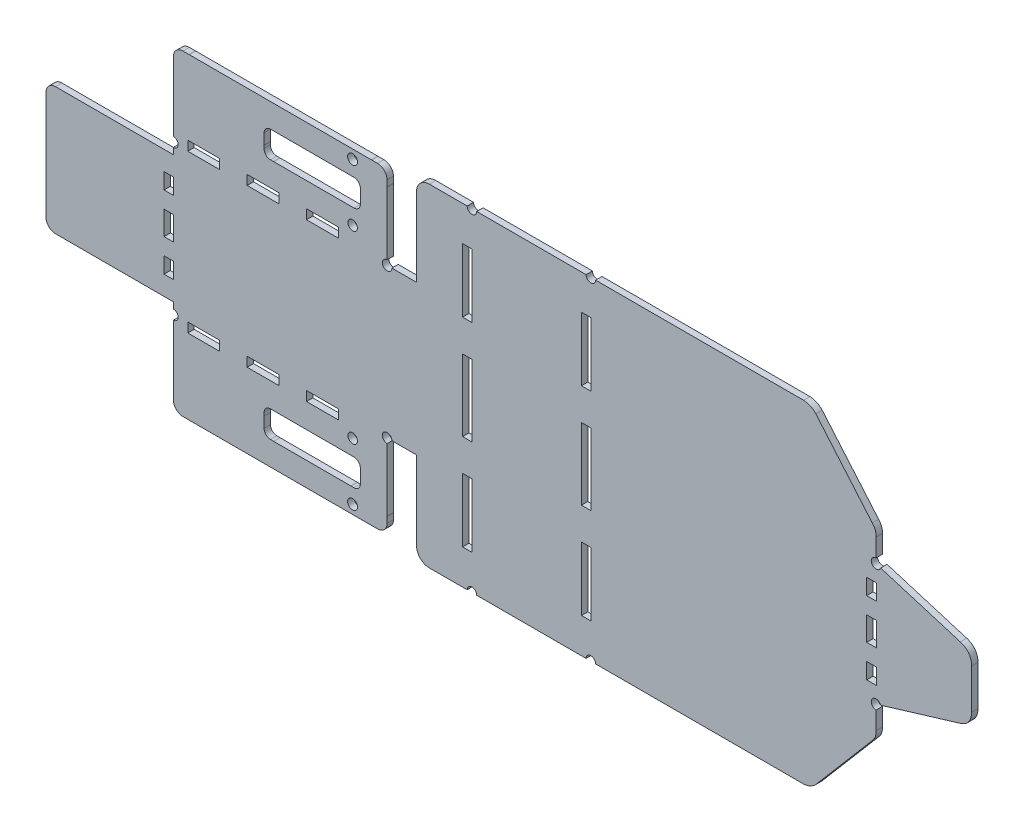
from build123d import *

# Parameters (mm, degrees)
MODEL_R                  = 1.565058428
MODEL_R_2                = 1.499491651
MODEL_W                  = 3
MODEL_H                  = 20
MODEL_W_2                = 10
MODEL_H_2                = 3
MODEL_H_3                = 22.475128394
MODEL_H_4                = 7.475128394
MODEL_H_5                = 5
RESSALTO_EXTRUS_O1_DEPTH = 2


with BuildPart() as part:
    # Model → Ressalto-extrusão1 (new body)
    with BuildSketch(Plane.XY):
        with BuildLine():
            Line((-37.913758519, 33.827030832), (-37.913758519, 63.827030832))
            Line((-37.913758519, 63.827030832), (-37.913758519, 65.827030832))
            ThreePointArc((-37.913758519, 65.827030832), (-37.035078863, 67.948351175), (-34.913758519, 68.827030832))
            Line((-34.913758519, 68.827030832), (-32.913758519, 68.827030832))
            Line((-32.913758519, 68.827030832), (2.086241481, 68.827030832))
            Line((2.086241481, 68.827030832), (2.086241481, 70.798296021))
            ThreePointArc((2.086241481, 70.798296021), (3.586241481, 72.298296021), (2.086241481, 73.798296021))
            Line((2.086241481, 73.798296021), (2.086241481, 93.521449254))
            Line((2.086241481, 93.521449254), (2.089156369, 93.692154805))
            Line((2.089156369, 93.692154805), (2.089156369, 95.518534366))
            ThreePointArc((2.089156369, 95.518534366), (2.967836026, 97.63985471), (5.089156369, 98.518534366))
            Line((5.089156369, 98.518534366), (6.91553593, 98.518534366))
            Line((6.91553593, 98.518534366), (7.086241481, 98.521449254))
            Line((7.086241481, 98.521449254), (64.178650092, 98.521449254))
            Line((64.178650092, 98.521449254), (64.349355643, 98.518534366))
            Line((64.349355643, 98.518534366), (66.175735204, 98.518534366))
            ThreePointArc((66.175735204, 98.518534366), (68.297055547, 97.63985471), (69.175735204, 95.518534366))
            Line((69.175735204, 95.518534366), (69.175735204, 93.692154805))
            Line((69.175735204, 93.692154805), (69.178650092, 93.521449254))
            Line((69.178650092, 93.521449254), (69.178650092, 73.798296021))
            ThreePointArc((69.178650092, 73.798296021), (68.11798992, 71.237635849), (70.678650092, 72.298296021))
            Line((70.678650092, 72.298296021), (78.413307207, 72.298296021))
            Line((78.413307207, 72.298296021), (78.413307207, 96.001255397))
            Line((78.413307207, 96.001255397), (78.413307207, 97.001255397))
            ThreePointArc((78.413307207, 97.001255397), (79.584880083, 99.829682522), (82.413307207, 101.001255397))
            Line((82.413307207, 101.001255397), (83.413307207, 101.001255397))
            Line((83.413307207, 101.001255397), (94.308618484, 101.001255397))
            ThreePointArc((94.308618484, 101.001255397), (95.808618484, 99.501255397), (97.308618484, 101.001255397))
            Line((97.308618484, 101.001255397), (131.635208551, 101.001255397))
            ThreePointArc((131.635208551, 101.001255397), (133.135208551, 99.501255397), (134.635208551, 101.001255397))
            Line((134.635208551, 101.001255397), (199.940156949, 101.001255397))
            add(Edge.make_bspline(
                [(199.940156949, 101.001255397), (202.179415573, 100.855441248), (203.746755471, 99.243138753)],
                knots=[0, 0, 0, 1, 1, 1], degree=2))
            Line((203.746755471, 99.243138753), (221.488437536, 78.410970135))
            add(Edge.make_bspline(
                [(221.488437536, 78.410970135), (222.762121913, 77.052932443), (222.681839015, 75.169086778)],
                knots=[0, 0, 0, 1, 1, 1], degree=2))
            Line((222.681839015, 75.169086778), (222.681839015, 69.497026257))
            ThreePointArc((222.681839015, 69.497026257), (221.445339271, 67.097014669), (224.117370065, 67.483328895))
            Line((224.117370065, 67.483328895), (249.131937115, 59.90280819))
            add(Edge.make_bspline(
                [(249.131937115, 59.90280819), (252.581492112, 58.852772143), (252.681839015, 55.11770469)],
                knots=[0, 0, 0, 1, 1, 1], degree=2))
            Line((252.681839015, 55.11770469), (252.681839015, 42.536356973))
            add(Edge.make_bspline(
                [(249.131937115, 37.751253474), (252.581492112, 38.80128952), (252.681839015, 42.536356973)],
                knots=[0, 0, 0, 1, 1, 1], degree=2))
            Line((249.131937115, 37.751253474), (224.117370065, 30.170732769))
            ThreePointArc((224.117370065, 30.170732769), (221.445339271, 30.557046995), (222.681839015, 28.157035406))
            Line((222.681839015, 28.157035406), (222.681839015, 22.484974885))
            add(Edge.make_bspline(
                [(221.488437536, 19.243091529), (222.762121913, 20.601129221), (222.681839015, 22.484974885)],
                knots=[0, 0, 0, 1, 1, 1], degree=2))
            Line((221.488437536, 19.243091529), (203.746755471, -1.58907709))
            add(Edge.make_bspline(
                [(199.940156949, -3.347193733), (202.179415573, -3.201379584), (203.746755471, -1.58907709)],
                knots=[0, 0, 0, 1, 1, 1], degree=2))
            Line((199.940156949, -3.347193733), (134.635208551, -3.347193733))
            ThreePointArc((134.635208551, -3.347193733), (133.135208551, -1.847193733), (131.635208551, -3.347193733))
            Line((131.635208551, -3.347193733), (97.308618484, -3.347193733))
            ThreePointArc((97.308618484, -3.347193733), (95.808618484, -1.847193733), (94.308618484, -3.347193733))
            Line((94.308618484, -3.347193733), (83.413307207, -3.347193733))
            Line((83.413307207, -3.347193733), (82.413307207, -3.347193733))
            ThreePointArc((82.413307207, -3.347193733), (79.584880083, -2.175620858), (78.413307207, 0.652806267))
            Line((78.413307207, 0.652806267), (78.413307207, 1.652806267))
            Line((78.413307207, 1.652806267), (78.413307207, 25.355765643))
            Line((78.413307207, 25.355765643), (70.678650092, 25.355765643))
            ThreePointArc((70.678650092, 25.355765643), (68.11798992, 26.416425814), (69.178650092, 23.855765643))
            Line((69.178650092, 23.855765643), (69.178650092, 4.132612409))
            Line((69.178650092, 4.132612409), (69.175735204, 3.961906858))
            Line((69.175735204, 3.961906858), (69.175735204, 2.135527297))
            ThreePointArc((69.175735204, 2.135527297), (68.297055547, 0.014206954), (66.175735204, -0.864472703))
            Line((66.175735204, -0.864472703), (64.349355643, -0.864472703))
            Line((64.349355643, -0.864472703), (64.178650092, -0.867387591))
            Line((64.178650092, -0.867387591), (7.086241481, -0.867387591))
            Line((7.086241481, -0.867387591), (6.91553593, -0.864472703))
            Line((6.91553593, -0.864472703), (5.089156369, -0.864472703))
            ThreePointArc((5.089156369, -0.864472703), (2.967836026, 0.014206954), (2.089156369, 2.135527297))
            Line((2.089156369, 2.135527297), (2.089156369, 3.961906858))
            Line((2.089156369, 3.961906858), (2.086241481, 4.132612409))
            Line((2.086241481, 4.132612409), (2.086241481, 23.855765643))
            ThreePointArc((2.086241481, 23.855765643), (3.586241481, 25.355765643), (2.086241481, 26.855765643))
            Line((2.086241481, 26.855765643), (2.086241481, 28.827030832))
            Line((2.086241481, 28.827030832), (-32.913758519, 28.827030832))
            Line((-32.913758519, 28.827030832), (-34.913758519, 28.827030832))
            ThreePointArc((-34.913758519, 28.827030832), (-37.035078863, 29.705710488), (-37.913758519, 31.827030832))
            Line((-37.913758519, 31.827030832), (-37.913758519, 33.827030832))
        make_face()
        with Locations((58.326419592, 95.720794846)):
            Circle(MODEL_R, mode=Mode.SUBTRACT)
        with Locations((58.364897566, 77.786537944)):
            Circle(MODEL_R_2, mode=Mode.SUBTRACT)
        with Locations((58.364897566, 19.86752372)):
            Circle(MODEL_R_2, mode=Mode.SUBTRACT)
        with Locations((58.326419592, 1.933266817)):
            Circle(MODEL_R, mode=Mode.SUBTRACT)
        Polygon((133.198496092, 47.589466635), (133.198496092, 37.589466635), (130.198496092, 37.589466635), (130.198496092, 60.064595029), (133.198496092, 60.064595029), (133.198496092, 50.064595029), align=None, mode=Mode.SUBTRACT)
        with Locations((94.371906025, 17.589466635)):
            Rectangle(MODEL_W, MODEL_H, mode=Mode.SUBTRACT)
        with Locations((131.698496092, 17.589466635)):
            Rectangle(MODEL_W, MODEL_H, mode=Mode.SUBTRACT)
        with Locations((30.234342773, 24.118201446)):
            Rectangle(MODEL_W_2, MODEL_H_2, mode=Mode.SUBTRACT)
        with Locations((11.599204746, 24.118201446)):
            Rectangle(MODEL_W_2, MODEL_H_2, mode=Mode.SUBTRACT)
        with Locations((48.8694808, 24.118201446)):
            Rectangle(MODEL_W_2, MODEL_H_2, mode=Mode.SUBTRACT)
        with Locations((94.371906025, 48.827030832)):
            Rectangle(MODEL_W, MODEL_H_3, mode=Mode.SUBTRACT)
        with Locations((0.649529023, 48.827030832)):
            Rectangle(MODEL_W, MODEL_H_4, mode=Mode.SUBTRACT)
        with Locations((0.649529023, 37.381816485)):
            Rectangle(MODEL_W, MODEL_H_5, mode=Mode.SUBTRACT)
        with Locations((221.245126556, 48.827030832)):
            Rectangle(MODEL_W, MODEL_H_4, mode=Mode.SUBTRACT)
        with Locations((221.245126556, 37.381816485)):
            Rectangle(MODEL_W, MODEL_H_5, mode=Mode.SUBTRACT)
        with BuildLine():
            Line((33.554621971, 14.967927618), (57.775787419, 14.967927618))
            Line((57.775787419, 14.967927618), (58.775787419, 14.967927618))
            ThreePointArc((58.775787419, 14.967927618), (60.190000981, 14.38214118), (60.775787419, 12.967927618))
            Line((60.775787419, 12.967927618), (60.775787419, 11.967927618))
            Line((60.775787419, 11.967927618), (60.775787419, 9.632836814))
            Line((60.775787419, 9.632836814), (60.774038486, 9.530413483))
            Line((60.774038486, 9.530413483), (60.774038486, 8.634585747))
            ThreePointArc((60.774038486, 8.634585747), (60.188252049, 7.220372184), (58.774038486, 6.634585747))
            Line((58.774038486, 6.634585747), (57.87821075, 6.634585747))
            Line((57.87821075, 6.634585747), (57.775787419, 6.632836814))
            Line((57.775787419, 6.632836814), (33.554621971, 6.632836814))
            Line((33.554621971, 6.632836814), (32.539243602, 6.640644476))
            ThreePointArc((32.539243602, 6.640644476), (31.134981746, 7.231819356), (30.554621971, 8.640585351))
            Line((30.554621971, 8.640585351), (30.554621971, 9.632836814))
            Line((30.554621971, 9.632836814), (30.554621971, 11.967927618))
            Line((30.554621971, 11.967927618), (30.556370904, 12.070350948))
            Line((30.556370904, 12.070350948), (30.541657231, 12.932032598))
            ThreePointArc((30.541657231, 12.932032598), (31.115130787, 14.368267809), (32.541365721, 14.966178685))
            Line((32.541365721, 14.966178685), (33.452198641, 14.966178685))
            Line((33.452198641, 14.966178685), (33.554621971, 14.967927618))
        make_face(mode=Mode.SUBTRACT)
        with BuildLine():
            Line((30.554621971, 88.02122485), (30.554621971, 89.013476312))
            ThreePointArc((30.554621971, 89.013476312), (31.134981746, 90.422242308), (32.539243602, 91.013417188))
            Line((32.539243602, 91.013417188), (33.554621971, 91.02122485))
            Line((33.554621971, 91.02122485), (57.775787419, 91.02122485))
            Line((57.775787419, 91.02122485), (57.87821075, 91.019475917))
            Line((57.87821075, 91.019475917), (58.774038486, 91.019475917))
            ThreePointArc((58.774038486, 91.019475917), (60.188252049, 90.433689479), (60.774038486, 89.019475917))
            Line((60.774038486, 89.019475917), (60.774038486, 88.12364818))
            Line((60.774038486, 88.12364818), (60.775787419, 88.02122485))
            Line((60.775787419, 88.02122485), (60.775787419, 85.686134046))
            Line((60.775787419, 85.686134046), (60.775787419, 84.686134046))
            ThreePointArc((60.775787419, 84.686134046), (60.190000981, 83.271920483), (58.775787419, 82.686134046))
            Line((58.775787419, 82.686134046), (57.775787419, 82.686134046))
            Line((57.775787419, 82.686134046), (33.554621971, 82.686134046))
            Line((33.554621971, 82.686134046), (33.452198641, 82.687882979))
            Line((33.452198641, 82.687882979), (32.541365721, 82.687882979))
            ThreePointArc((32.541365721, 82.687882979), (31.115130787, 83.285793854), (30.541657231, 84.722029066))
            Line((30.541657231, 84.722029066), (30.556370904, 85.583710715))
            Line((30.556370904, 85.583710715), (30.554621971, 85.686134046))
            Line((30.554621971, 85.686134046), (30.554621971, 88.02122485))
        make_face(mode=Mode.SUBTRACT)
        with Locations((221.245126556, 60.272245179)):
            Rectangle(MODEL_W, MODEL_H_5, mode=Mode.SUBTRACT)
        with Locations((0.649529023, 60.272245179)):
            Rectangle(MODEL_W, MODEL_H_5, mode=Mode.SUBTRACT)
        with Locations((48.8694808, 73.535860218)):
            Rectangle(MODEL_W_2, MODEL_H_2, mode=Mode.SUBTRACT)
        with Locations((11.599204746, 73.535860218)):
            Rectangle(MODEL_W_2, MODEL_H_2, mode=Mode.SUBTRACT)
        with Locations((30.234342773, 73.535860218)):
            Rectangle(MODEL_W_2, MODEL_H_2, mode=Mode.SUBTRACT)
        with Locations((131.698496092, 80.064595029)):
            Rectangle(MODEL_W, MODEL_H, mode=Mode.SUBTRACT)
        with Locations((94.371906025, 80.064595029)):
            Rectangle(MODEL_W, MODEL_H, mode=Mode.SUBTRACT)
    extrude(amount=RESSALTO_EXTRUS_O1_DEPTH)


solid = part.part
